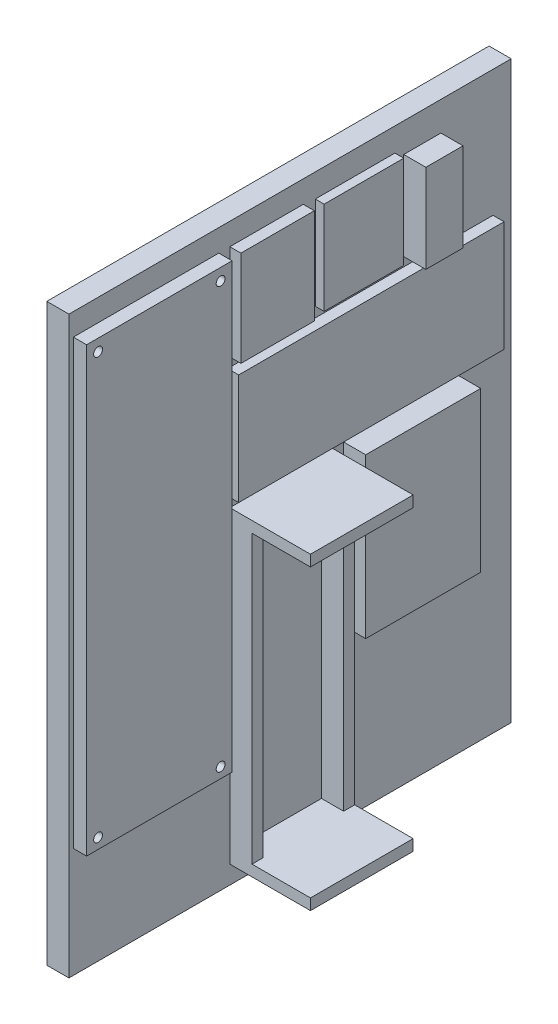
from build123d import *

# Parameters (mm, degrees)
SKETCH1_W            = 100
SKETCH1_H            = 130
SKETCH1_W_2          = 32.89
SKETCH1_H_2          = 100.13
SKETCH1_R            = 1
BOSS_EXTRUDE1_DEPTH  = 5
SKETCH3_W            = 32.89
SKETCH3_H            = 100.13
SKETCH3_R            = 1
BOSS_EXTRUDE3_DEPTH  = 3
SKETCH4_W            = 16.6
SKETCH4_H            = 21.6
BOSS_EXTRUDE4_DEPTH  = 2.5
SKETCH5_W            = 60
SKETCH5_H            = 25
BOSS_EXTRUDE5_DEPTH  = 2.5
SKETCH6_W            = 18
SKETCH6_H            = 21
BOSS_EXTRUDE6_DEPTH  = 2
SKETCH7_W            = 8.4
SKETCH7_H            = 20
BOSS_EXTRUDE7_DEPTH  = 5
SKETCH9_W            = 2.5
SKETCH9_H            = 64.8
BOSS_EXTRUDE8_DEPTH  = 5
SKETCH10_W           = 23.22
SKETCH10_H           = 2.5
BOSS_EXTRUDE9_DEPTH  = 18.22
SKETCH12_W           = 26
SKETCH12_H           = 36
BOSS_EXTRUDE11_DEPTH = 5
SKETCH11_W           = 26
SKETCH11_H           = 36
BOSS_EXTRUDE10_DEPTH = 5


with BuildPart() as part:
    # Sketch1 → Boss-Extrude1 (new body)
    # profile 1 of 2: a face of its own
    with BuildSketch(Plane(origin=(0, 0, 0), x_dir=(0, 0, -1), z_dir=(1, 0, 0))):
        with Locations((32.555, -9.935)):
            Rectangle(SKETCH1_W, SKETCH1_H)
        Rectangle(SKETCH1_W_2, SKETCH1_H_2, mode=Mode.SUBTRACT)
    # profile 2 of 2: a face of its own
    with BuildSketch(Plane(origin=(0, 0, 0), x_dir=(0, 0, -1), z_dir=(1, 0, 0))):
        Rectangle(SKETCH1_W_2, SKETCH1_H_2)
        with Locations((-13.855, -47.705)):
            Circle(SKETCH1_R, mode=Mode.SUBTRACT)
        with Locations((13.855, -47.705)):
            Circle(SKETCH1_R, mode=Mode.SUBTRACT)
        with Locations((13.855, 47.395)):
            Circle(SKETCH1_R, mode=Mode.SUBTRACT)
        with Locations((-13.855, 47.395)):
            Circle(SKETCH1_R, mode=Mode.SUBTRACT)
    extrude(amount=BOSS_EXTRUDE1_DEPTH)

    # Sketch3 → Boss-Extrude3 (add)
    with BuildSketch(Plane(origin=(5, 0, 0), x_dir=(0, 0, -1), z_dir=(1, 0, 0))):
        Rectangle(SKETCH3_W, SKETCH3_H)
        with Locations((-13.855, 47.395)):
            Circle(SKETCH3_R, mode=Mode.SUBTRACT)
        with Locations((13.855, 47.395)):
            Circle(SKETCH3_R, mode=Mode.SUBTRACT)
        with Locations((13.855, -47.705)):
            Circle(SKETCH3_R, mode=Mode.SUBTRACT)
        with Locations((-13.855, -47.705)):
            Circle(SKETCH3_R, mode=Mode.SUBTRACT)
    extrude(amount=BOSS_EXTRUDE3_DEPTH)

    # Sketch4 → Boss-Extrude4 (add)
    with BuildSketch(Plane(origin=(5, 0, 0), x_dir=(0, 0, -1), z_dir=(1, 0, 0))):
        with Locations((27.245, 39.265)):
            Rectangle(SKETCH4_W, SKETCH4_H)
    extrude(amount=BOSS_EXTRUDE4_DEPTH)

    # Sketch5 → Boss-Extrude5 (add)
    with BuildSketch(Plane(origin=(5, 0, 0), x_dir=(0, 0, -1), z_dir=(1, 0, 0))):
        with Locations((48.445, 13.965)):
            Rectangle(SKETCH5_W, SKETCH5_H)
    extrude(amount=BOSS_EXTRUDE5_DEPTH)

    # Sketch6 → Boss-Extrude6 (add)
    with BuildSketch(Plane(origin=(5, 0, 0), x_dir=(0, 0, -1), z_dir=(1, 0, 0))):
        with Locations((47.260487744, 39.246233232)):
            Rectangle(SKETCH6_W, SKETCH6_H)
    extrude(amount=BOSS_EXTRUDE6_DEPTH)

    # Sketch7 → Boss-Extrude7 (add)
    with BuildSketch(Plane(origin=(5, 0, 0), x_dir=(0, 0, -1), z_dir=(1, 0, 0))):
        with Locations((62.460487744, 38.465)):
            Rectangle(SKETCH7_W, SKETCH7_H)
    extrude(amount=BOSS_EXTRUDE7_DEPTH)

    # Sketch9 → Boss-Extrude8 (add)
    with BuildSketch(Plane(origin=(5, 0, 0), x_dir=(0, 0, -1), z_dir=(1, 0, 0))):
        with Locations((20.195, -35.935)):
            Rectangle(SKETCH9_W, SKETCH9_H)
        with Locations((40.915, -35.935)):
            Rectangle(SKETCH9_W, SKETCH9_H)
    extrude(amount=BOSS_EXTRUDE8_DEPTH)

    # Sketch10 → Boss-Extrude9 (add)
    with BuildSketch(Plane(origin=(5, 0, 0), x_dir=(0, 0, -1), z_dir=(1, 0, 0))):
        with Locations((30.555, -69.585)):
            Rectangle(SKETCH10_W, SKETCH10_H)
        with Locations((30.555, -2.285)):
            Rectangle(SKETCH10_W, SKETCH10_H)
    extrude(amount=BOSS_EXTRUDE9_DEPTH)

    # Sketch12 → Boss-Extrude11 (add)
    with BuildSketch(Plane(origin=(5, 0, 0), x_dir=(0, 0, -1), z_dir=(1, 0, 0))):
        with Locations((57.665, -19.035)):
            Rectangle(SKETCH12_W, SKETCH12_H)
    extrude(amount=BOSS_EXTRUDE11_DEPTH)

    # Sketch11 → Boss-Extrude10 (add)
    with BuildSketch(Plane(origin=(5, 0, 0), x_dir=(0, 0, -1), z_dir=(1, 0, 0))):
        with Locations((57.665, -19.035)):
            Rectangle(SKETCH11_W, SKETCH11_H)
    extrude(amount=BOSS_EXTRUDE10_DEPTH)


solid = part.part
